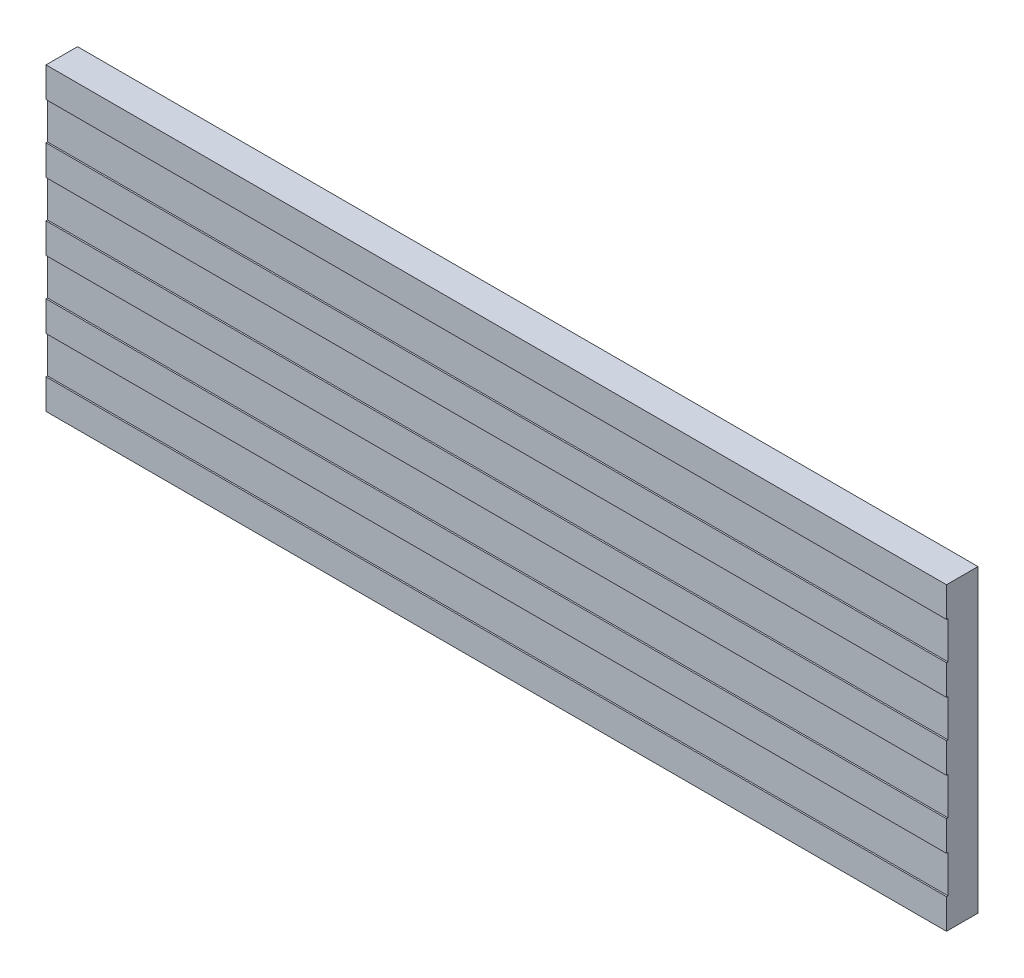
from build123d import *

# Parameters (mm, degrees)
ESQUISSE1_W        = 600
ESQUISSE1_H        = 200
BOSS_EXTRU_1_DEPTH = 20
ESQUISSE2_W        = 600
ESQUISSE2_H        = 20
BOSS_EXTRU_2_DEPTH = 1


with BuildPart() as part:
    # Esquisse1 → Boss.-Extru.1 (new body)
    with BuildSketch(Plane.XY):
        with Locations((254.990116202, -80.009576749)):
            Rectangle(ESQUISSE1_W, ESQUISSE1_H)
    extrude(amount=BOSS_EXTRU_1_DEPTH)

    # Esquisse2 → Boss.-Extru.2 (add)
    with BuildSketch(Plane.XY.offset(20)):
        with Locations((254.990116202, 9.990423251)):
            Rectangle(ESQUISSE2_W, ESQUISSE2_H)
        with Locations((254.990116202, -35.009576749)):
            Rectangle(ESQUISSE2_W, ESQUISSE2_H)
        with Locations((254.990116202, -80.009576749)):
            Rectangle(ESQUISSE2_W, ESQUISSE2_H)
        with Locations((254.990116202, -125.009576749)):
            Rectangle(ESQUISSE2_W, ESQUISSE2_H)
        with Locations((254.990116202, -170.009576749)):
            Rectangle(ESQUISSE2_W, ESQUISSE2_H)
    extrude(amount=BOSS_EXTRU_2_DEPTH)


solid = part.part
